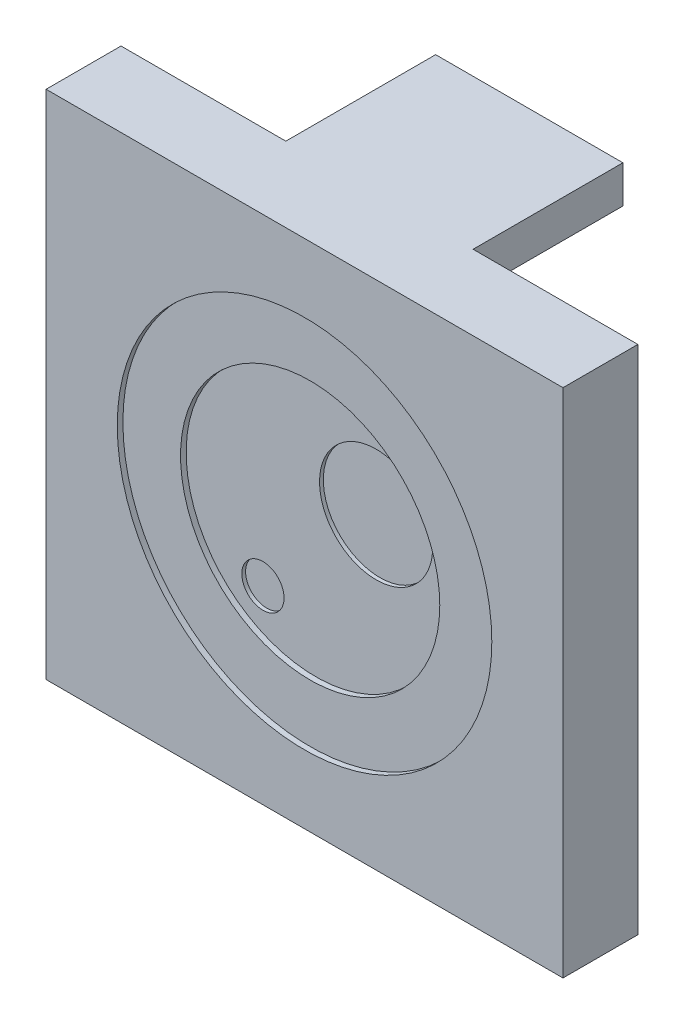
from build123d import *

# Parameters (mm, degrees)
SKETCH_1_W          = 27.6
SKETCH_1_H          = 27.3
EXTRUDE_1_DEPTH     = 4
CUT_EXTRUDE_START   = 4
SKETCH_2_R          = 10
CUT_EXTRUDE_1_DEPTH = 0.3
SKETCH_2_3_R        = 6.921661
CUT_EXTRUDE_7_DEPTH = 0.6
SKETCH_2_5_R        = 1.127346788
SKETCH_2_5_R_2      = 3.020554036
CUT_EXTRUDE_8_DEPTH = 0.8
SKETCH_3_W          = 10
SKETCH_3_H          = 2
EXTRUDE_2_DEPTH     = 8


with BuildPart() as part:
    # 草图1 → 凸台-拉伸1 (new body)
    with BuildSketch(Plane.XY):
        Rectangle(SKETCH_1_W, SKETCH_1_H)
    extrude(amount=EXTRUDE_1_DEPTH)

    # 草图2 → 切除-拉伸1 (cut)
    with BuildSketch(Plane.XY.offset(CUT_EXTRUDE_START)):
        Circle(SKETCH_2_R)
    extrude(amount=-CUT_EXTRUDE_1_DEPTH, mode=Mode.SUBTRACT)

    # 草图2<3> → 切除-拉伸7 (cut)
    with BuildSketch(Plane.XY.offset(CUT_EXTRUDE_START)):
        Circle(SKETCH_2_3_R)
    extrude(amount=-CUT_EXTRUDE_7_DEPTH, mode=Mode.SUBTRACT)

    # 草图2<5> → 切除-拉伸8 (cut)
    with BuildSketch(Plane.XY.offset(CUT_EXTRUDE_START)):
        with Locations((-2.821175222, -4.128071022)):
            Circle(SKETCH_2_5_R)
        with Locations((3.223015918, 2.197908993)):
            Circle(SKETCH_2_5_R_2)
    extrude(amount=-CUT_EXTRUDE_8_DEPTH, mode=Mode.SUBTRACT)

    # 草图3 → 凸台-拉伸2 (add)
    with BuildSketch(Plane(origin=(0, 0, 0), x_dir=(-1, 0, 0), z_dir=(0, 0, -1))):
        with Locations((0, 12.65)):
            Rectangle(SKETCH_3_W, SKETCH_3_H)
    extrude(amount=EXTRUDE_2_DEPTH)


solid = part.part
